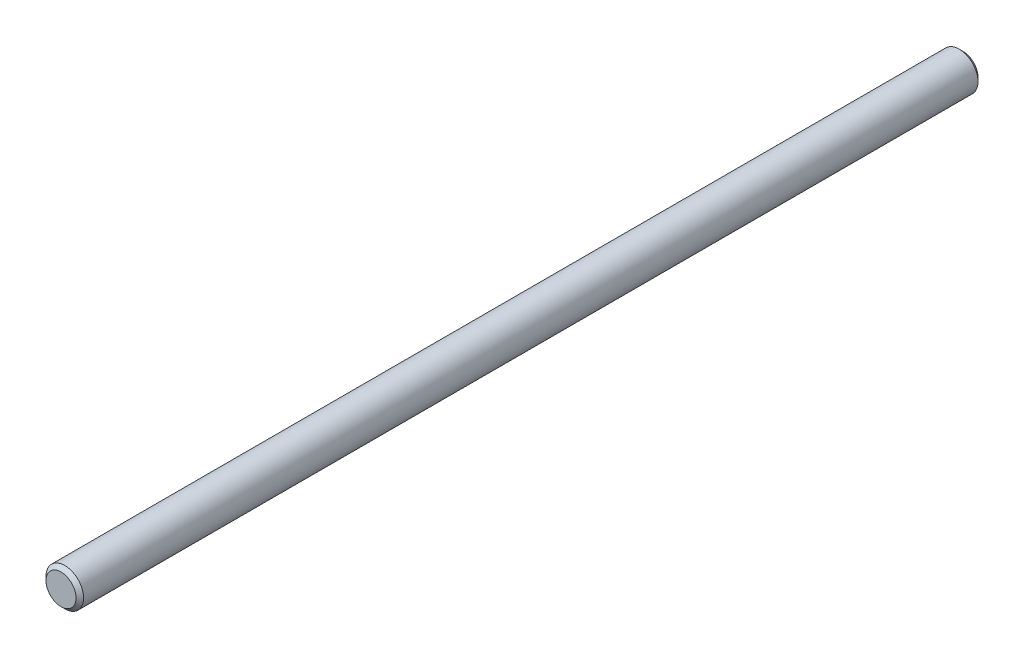
from build123d import *

# Parameters (mm, degrees)
SKETCH1_R           = 2.5
BOSS_EXTRUDE1_DEPTH = 60
CHAMFER1_SIZE       = 0.5


with BuildPart() as part:
    # Sketch1 → Boss-Extrude1 (new, symmetric)
    with BuildSketch(Plane.XY):
        Circle(SKETCH1_R)
    extrude(amount=BOSS_EXTRUDE1_DEPTH, both=True)

    # Chamfer1
    chamfer1_edges = [part.edges().sort_by_distance(p)[0] for p in [
        (-2.5, 0, -60),
        (-2.5, 0, 60),
    ]]
    chamfer(chamfer1_edges, length=CHAMFER1_SIZE)


solid = part.part
